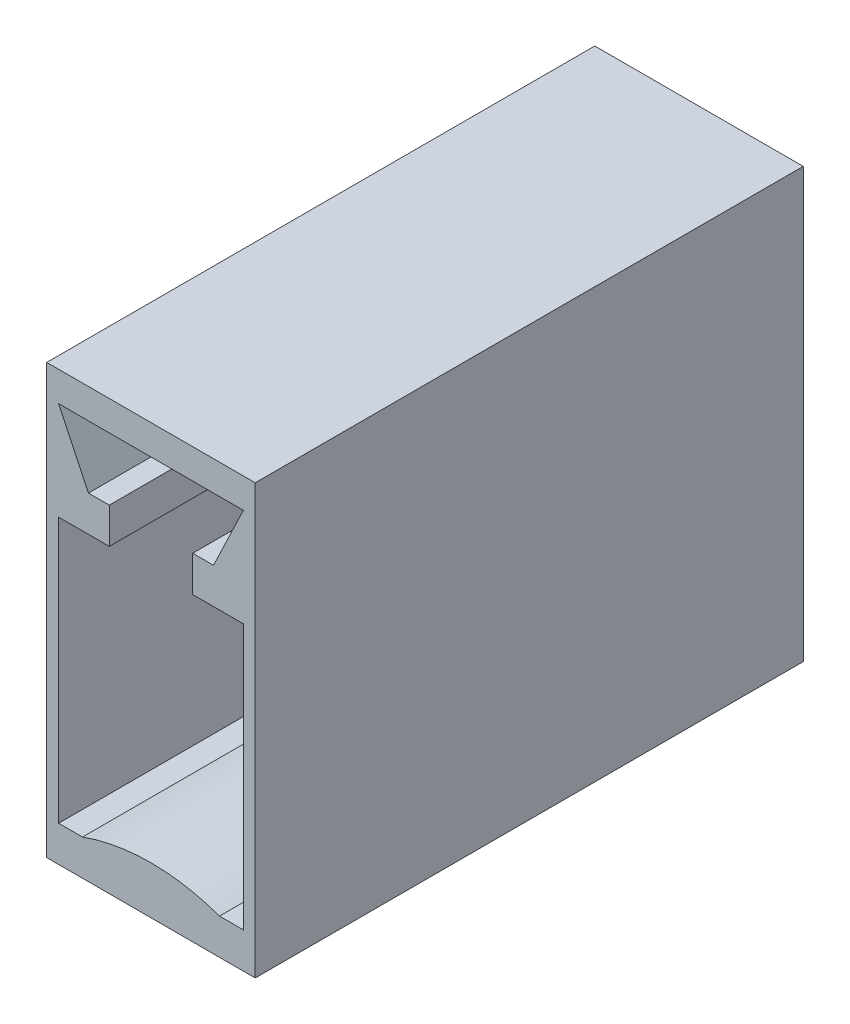
from build123d import *

# Parameters (mm, degrees)
SKETCH_1_W           = 3.5
SKETCH_1_H           = 9.2
EXTRUDE_1_DEPTH      = 7.2
SKETCH_2_W           = 2.75
SKETCH_2_H           = 3.05
CUT_EXTRUDE_1_DEPTH  = 0.4
SKETCH_5_W           = 2.75
SKETCH_5_H           = 3.8
CUT_EXTRUDE_4_DEPTH  = 0.4
CUT_EXTRUDE_6_REACH  = 10.533
SKETCH_9_R           = 0.9
EXTRUDE_3_DEPTH      = 1.3
SKETCH_10_W          = 0.8
SKETCH_10_H          = 3
CUT_EXTRUDE_7_DEPTH  = 1.2
SKETCH_11_W          = 0.8
SKETCH_11_H          = 2
CUT_EXTRUDE_8_DEPTH  = 0.8
FILLET_2_R           = 0.2
CUT_EXTRUDE_12_REACH = 11.445
DRAFT_3_ANGLE        = -25.463345062
DRAFT_4_ANGLE        = -25.463345062
CUT_EXTRUDE_15_REACH = 11.445
SKETCH_18_W          = 0.4
SKETCH_18_H          = 1.9
CUT_EXTRUDE_16_REACH = 11.445
SKETCH_19_W          = 0.4
SKETCH_19_H          = 1.9


with BuildPart() as part:
    # Эскиз1 → Бобышка-Вытянуть1 (new body)
    with BuildSketch(Plane.XZ.offset(3.6)):
        with Locations((-1.75, 0)):
            Rectangle(SKETCH_1_W, SKETCH_1_H)
    extrude(amount=-EXTRUDE_1_DEPTH)

    # Эскиз2 → Вырез-Вытянуть1 (cut)
    with BuildSketch(Plane.XZ.offset(3.6)):
        with Locations((-1.75, -3.075)):
            Rectangle(SKETCH_2_W, SKETCH_2_H)
    extrude(amount=-CUT_EXTRUDE_1_DEPTH, mode=Mode.SUBTRACT)

    # Эскиз5 → Вырез-Вытянуть4 (cut)
    with BuildSketch(Plane(origin=(0, 0, -4.6), x_dir=(-1, 0, 0), z_dir=(0, 0, -1))):
        with Locations((1.75, -1.3)):
            Rectangle(SKETCH_5_W, SKETCH_5_H)
    extrude(amount=-CUT_EXTRUDE_4_DEPTH, mode=Mode.SUBTRACT)

    # Эскиз7 → Вырез-Вытянуть6 (cut, up to next)
    with BuildSketch(Plane(origin=(0, 0, -2.3), x_dir=(-1, 0, 0), z_dir=(0, 0, -1)), mode=Mode.PRIVATE) as cut_extrude_6_sk1:
        with BuildLine():
            Line((3.3, -1.1), (3.3, -0.1))
            Line((3.3, -0.1), (2.9, -0.1))
            Line((2.9, -0.1), (2.9, 1.1))
            Line((2.9, 1.1), (0.6, 1.1))
            Line((0.6, 1.1), (0.6, -0.1))
            Line((0.6, -0.1), (0.2, -0.1))
            Line((0.2, -0.1), (0.2, -1.1))
            Line((0.2, -1.1), (0.6, -1.1))
            Line((0.6, -1.1), (0.6, -3))
            ThreePointArc((0.6, -3), (1.75, -2.8), (2.9, -3))
            Line((2.9, -3), (2.9, -1.1))
            Line((2.9, -1.1), (3.3, -1.1))
        make_face()
    cut_extrude_6_tool1 = extrude(cut_extrude_6_sk1.sketch, amount=-CUT_EXTRUDE_6_REACH, mode=Mode.PRIVATE) & part.part
    add(cut_extrude_6_tool1.solids().sort_by_distance((-1.75, -0.860527, -2.3))[0], mode=Mode.SUBTRACT)

    # Эскиз9 → Бобышка-Вытянуть3 (add)
    with BuildSketch(Plane.XY.offset(-1)):
        with Locations((-1.75, -0.6)):
            Circle(SKETCH_9_R)
    extrude(amount=-EXTRUDE_3_DEPTH)

    # Эскиз10 → Вырез-Вытянуть7 (cut)
    with BuildSketch(Plane(origin=(0, 0, -4.2), x_dir=(-1, 0, 0), z_dir=(0, 0, -1))):
        with Locations((1.75, -1.7)):
            Rectangle(SKETCH_10_W, SKETCH_10_H)
    extrude(amount=-CUT_EXTRUDE_7_DEPTH, mode=Mode.SUBTRACT)

    # Эскиз11 → Вырез-Вытянуть8 (cut)
    with BuildSketch(Plane(origin=(0, -0.2, 0), x_dir=(1, 0, 0), z_dir=(0, 1, 0))):
        with Locations((-1.75, 2)):
            Rectangle(SKETCH_11_W, SKETCH_11_H)
    extrude(amount=-CUT_EXTRUDE_8_DEPTH, mode=Mode.SUBTRACT)

    # Скругление2
    fillet_2_edges = [part.edges().sort_by_distance(p)[0] for p in [
        (-2.65, -0.6, -1),
    ]]
    fillet(fillet_2_edges, radius=FILLET_2_R)

    # Эскиз15 → Вырез-Вытянуть12 (cut, up to next)
    with BuildSketch(Plane(origin=(0, 0, -3.4), x_dir=(-1, 0, 0), z_dir=(0, 0, -1)), mode=Mode.PRIVATE) as cut_extrude_12_sk1:
        Polygon((1.05, 2.05), (1.05, 1.45), (0.2, 1.45), (0.2, -0.1), (0.6, -0.1), (0.6, 1.1), (2.9, 1.1), (2.9, -0.1), (3.3, -0.1), (3.3, 1.45), (2.45, 1.45), (2.45, 2.05), (3.3, 2.05), (3.3, 3.1), (0.2, 3.1), (0.2, 2.05), align=None)
    cut_extrude_12_tool1 = extrude(cut_extrude_12_sk1.sketch, amount=-CUT_EXTRUDE_12_REACH, mode=Mode.PRIVATE) & part.part
    add(cut_extrude_12_tool1.solids().sort_by_distance((-1.75, 1.90798, -3.4))[0], mode=Mode.SUBTRACT)

    # Уклон3
    draft_3_faces = [part.faces().sort_by_distance(p)[0] for p in [
        (-0.2, 2.575, 0.6),
    ]]
    draft(draft_3_faces, Plane(origin=(-3.3, 3.1, 4.601), x_dir=(0, 0, -1), z_dir=(0, -1, 0)), DRAFT_3_ANGLE)

    # Уклон4
    draft_4_faces = [part.faces().sort_by_distance(p)[0] for p in [
        (-3.3, 2.575, 0.6),
    ]]
    draft(draft_4_faces, Plane(origin=(-3.3, 3.1, 4.601), x_dir=(0, 0, -1), z_dir=(0, -1, 0)), DRAFT_4_ANGLE)

    # Эскиз18 → Вырез-Вытянуть15 (cut, up to next)
    with BuildSketch(Plane(origin=(0, 0, -3.4), x_dir=(-1, 0, 0), z_dir=(0, 0, -1)), mode=Mode.PRIVATE) as cut_extrude_15_sk1:
        with Locations((0.4, -2.05)):
            Rectangle(SKETCH_18_W, SKETCH_18_H)
    cut_extrude_15_tool1 = extrude(cut_extrude_15_sk1.sketch, amount=-CUT_EXTRUDE_15_REACH, mode=Mode.PRIVATE) & part.part
    add(cut_extrude_15_tool1.solids().sort_by_distance((-0.4, -2.05, -3.4))[0], mode=Mode.SUBTRACT)

    # Эскиз19 → Вырез-Вытянуть16 (cut, up to next)
    with BuildSketch(Plane(origin=(0, 0, -3.4), x_dir=(-1, 0, 0), z_dir=(0, 0, -1)), mode=Mode.PRIVATE) as cut_extrude_16_sk1:
        with Locations((3.1, -2.05)):
            Rectangle(SKETCH_19_W, SKETCH_19_H)
    cut_extrude_16_tool1 = extrude(cut_extrude_16_sk1.sketch, amount=-CUT_EXTRUDE_16_REACH, mode=Mode.PRIVATE) & part.part
    add(cut_extrude_16_tool1.solids().sort_by_distance((-3.1, -2.05, -3.4))[0], mode=Mode.SUBTRACT)


solid = part.part
